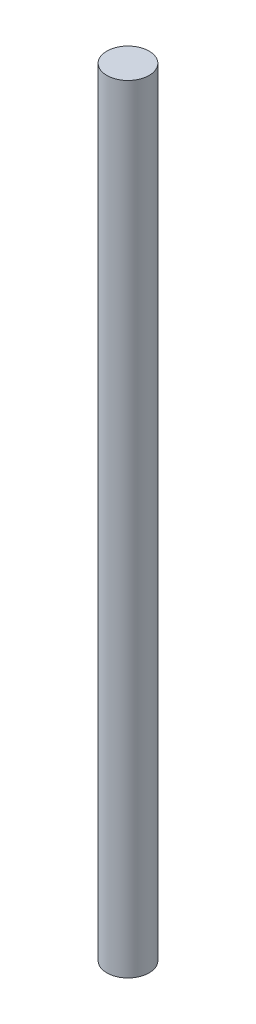
from build123d import *

# Parameters (mm, degrees)
IZIM1_R                     = 5
Y_KSEKLIK_EKSTR_ZYON1_DEPTH = 184


with BuildPart() as part:
    # Çizim1 → Yükseklik-Ekstrüzyon1 (new body)
    with BuildSketch(Plane(origin=(0, 0, 0), x_dir=(1, 0, 0), z_dir=(0, 1, 0))):
        with Locations(Location((0, 0, 0), (0, 0, 270))):
            Circle(IZIM1_R)
    extrude(amount=Y_KSEKLIK_EKSTR_ZYON1_DEPTH)


solid = part.part
